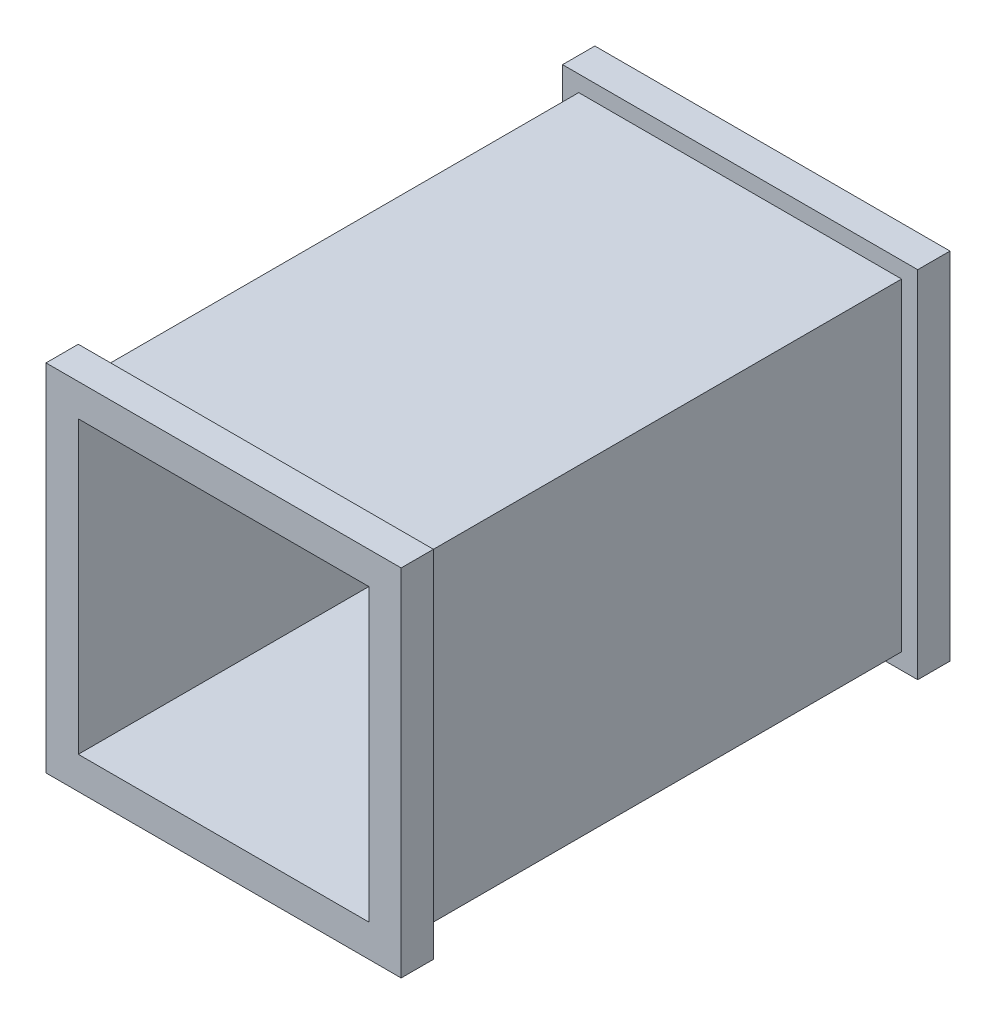
from build123d import *

# Parameters (mm, degrees)
SKETCH5_W           = 279.4
SKETCH5_H           = 279.4
SKETCH5_W_2         = 228.6
SKETCH5_H_2         = 228.6
BOSS_EXTRUDE1_DEPTH = 25.4
SKETCH7_W           = 279.4
SKETCH7_H           = 279.4
SKETCH7_W_2         = 228.6
SKETCH7_H_2         = 228.6
BOSS_EXTRUDE4_DEPTH = 25.4


with BuildPart() as part:
    # Sketch2 → Loft1 section 0
    with BuildSketch(Plane.XY.offset(381)):
        with BuildLine():
            Line((-127, -127), (127, -127))
            Line((127, -127), (127, 127))
            Line((127, 127), (-127, 127))
            Line((-127, 127), (-127, -127))
        make_face()
    # Sketch1 → Loft1 section 1
    with BuildSketch(Plane.XY):
        with BuildLine():
            Line((-127, -127), (127, -127))
            Line((127, -127), (127, 127))
            Line((127, 127), (-127, 127))
            Line((-127, 127), (-127, -127))
        make_face()
    loft()

    # Sketch4 → Cut-Loft1 section 0
    with BuildSketch(Plane(origin=(0, 0, 0), x_dir=(-1, 0, 0), z_dir=(0, 0, -1))):
        with BuildLine():
            Line((-114.3, -114.3), (114.3, -114.3))
            Line((114.3, -114.3), (114.3, 114.3))
            Line((114.3, 114.3), (-114.3, 114.3))
            Line((-114.3, 114.3), (-114.3, -114.3))
        make_face()
    # Sketch3 → Cut-Loft1 section 1
    with BuildSketch(Plane.XY.offset(381)):
        with BuildLine():
            Line((114.3, -114.3), (114.3, 114.3))
            Line((114.3, 114.3), (-114.3, 114.3))
            Line((-114.3, 114.3), (-114.3, -114.3))
            Line((-114.3, -114.3), (114.3, -114.3))
        make_face()
    loft(mode=Mode.SUBTRACT)

    # Sketch5 → Boss-Extrude1 (add)
    with BuildSketch(Plane(origin=(0, 0, 0), x_dir=(-1, 0, 0), z_dir=(0, 0, -1))):
        Rectangle(SKETCH5_W, SKETCH5_H)
        Rectangle(SKETCH5_W_2, SKETCH5_H_2, mode=Mode.SUBTRACT)
    extrude(amount=BOSS_EXTRUDE1_DEPTH)

    # Sketch7 → Boss-Extrude4 (add)
    with BuildSketch(Plane.XY.offset(381)):
        Rectangle(SKETCH7_W, SKETCH7_H)
        Rectangle(SKETCH7_W_2, SKETCH7_H_2, mode=Mode.SUBTRACT)
    extrude(amount=BOSS_EXTRUDE4_DEPTH)


solid = part.part
